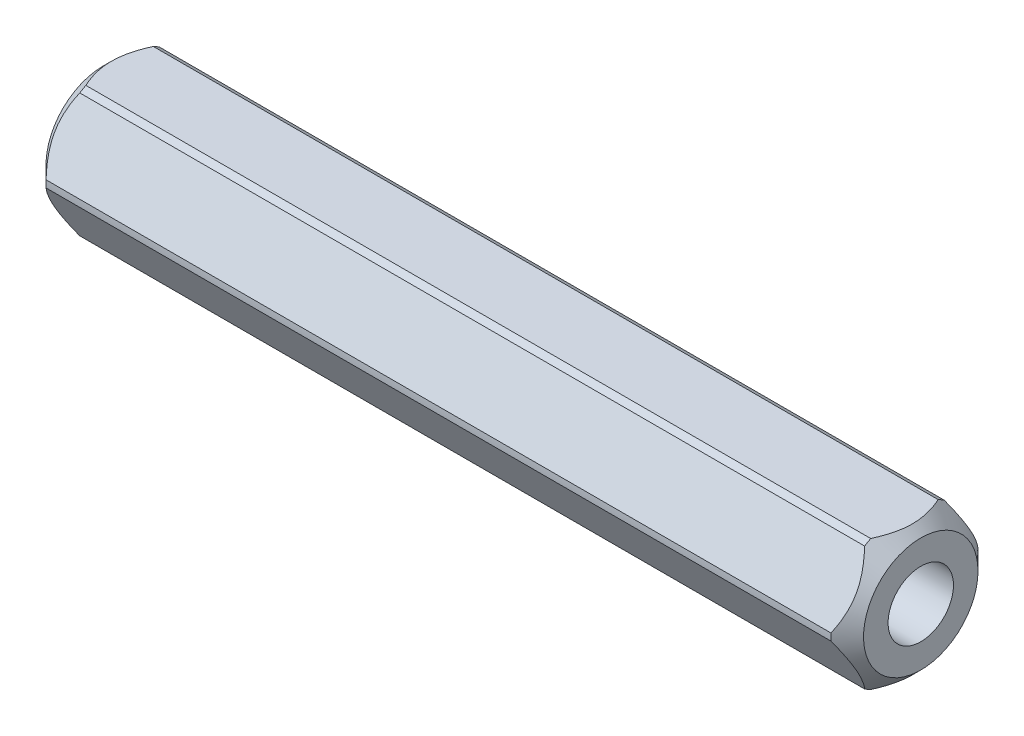
from build123d import *

# Parameters (mm, degrees)
EXTRUDE_310_DEPTH          = 25
CUT_EXTRUDE_411_DEPTH      = 26.735837529
CUT_EXTRUDE_411_DEPTH_BACK = 26.735837529
SKETCH_8_R                 = 5.5
SKETCH_8_R_2               = 4.5
CUT_EXTRUDE_596_DEPTH      = 26.714781741
CUT_EXTRUDE_596_DEPTH_BACK = 26.714781741
SKETCH_9_R                 = 2


with BuildPart() as part:
    # 草图1 → Extrude 310 (new, symmetric)
    with BuildSketch(Plane(origin=(0, 0, 0), x_dir=(0, 0, -1), z_dir=(1, 0, 0))):
        Polygon((4.618802154, 0), (2.309401077, 4), (-2.309401077, 4), (-4.618802154, 0), (-2.309401077, -4), (2.309401077, -4), align=None)
    extrude(amount=EXTRUDE_310_DEPTH, both=True)

    # 草图8 → Cut-Extrude 411 (cut, two sides: drawn at the far end of the back side and taken through both)
    with BuildSketch(Plane(origin=(0, 0, 0), x_dir=(0, 0, -1), z_dir=(1, 0, 0)).offset(-CUT_EXTRUDE_411_DEPTH_BACK)):
        Circle(SKETCH_8_R)
        Circle(SKETCH_8_R_2, mode=Mode.SUBTRACT)
    extrude(amount=CUT_EXTRUDE_411_DEPTH + CUT_EXTRUDE_411_DEPTH_BACK, mode=Mode.SUBTRACT)

    # 草图9 → Cut-Extrude 596 (cut, two sides: drawn at the far end of the back side and taken through both)
    with BuildSketch(Plane(origin=(0, 0, 0), x_dir=(0, 0, -1), z_dir=(1, 0, 0)).offset(-CUT_EXTRUDE_596_DEPTH_BACK)):
        Circle(SKETCH_9_R)
    extrude(amount=CUT_EXTRUDE_596_DEPTH + CUT_EXTRUDE_596_DEPTH_BACK, mode=Mode.SUBTRACT)

    # 草图10 → Cut-Revolve 886 (revolve, cut)
    with BuildSketch(Plane.XY, mode=Mode.PRIVATE) as cut_revolve_886_sk:
        Polygon((-25.5, 4.5), (-24, 4.5), (-25.5, 3), align=None)
        Polygon((24, 4.5), (25.5, 3), (25.5, 4.5), align=None)
    revolve(cut_revolve_886_sk.sketch.rotate(Axis((25, 0, 0), (-1, 0, 0)), 267.266044451), axis=Axis((25, 0, 0), (-1, 0, 0)), mode=Mode.SUBTRACT)


solid = part.part
